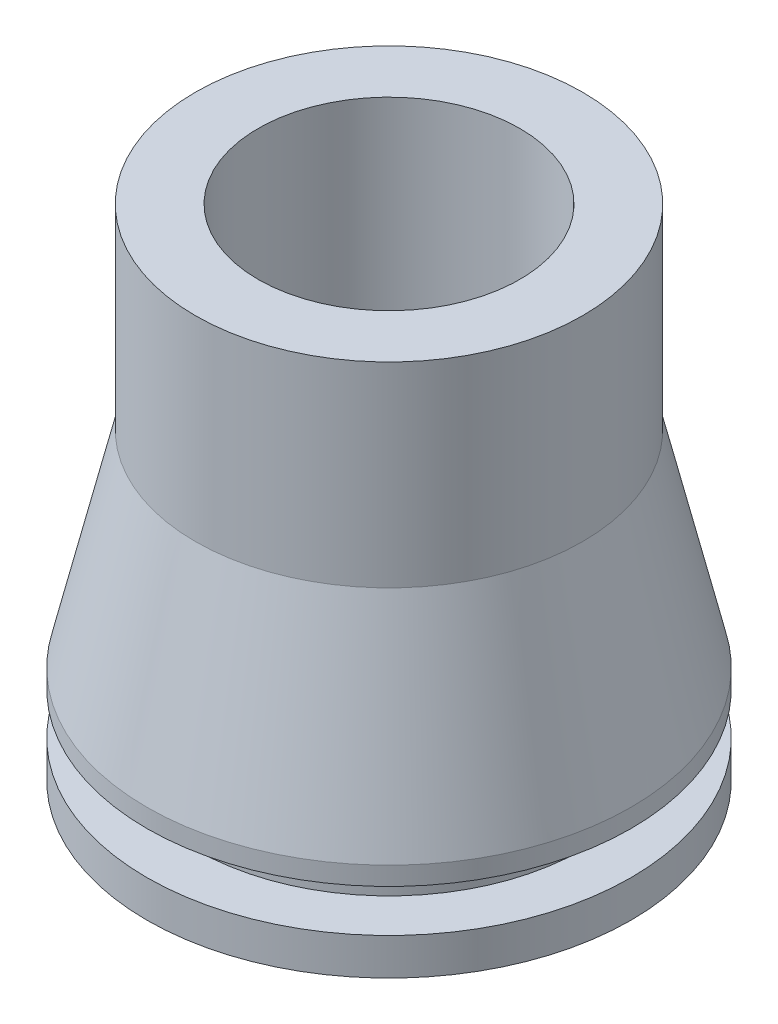
from build123d import *


with BuildPart() as part:
    # Sketch1 → Revolve1 (revolve)
    with BuildSketch(Plane.XY, mode=Mode.PRIVATE) as revolve1_sk:
        Polygon((3.60045, 0), (3.60045, 13.7414), (5.32765, 13.7414), (5.32765, 8.3566), (6.66115, 2.6924), (6.66115, 2.1844), (5.32765, 2.1844), (5.32765, 1.016), (6.66115, 1.016), (6.66115, 0), align=None)
    revolve(revolve1_sk.sketch.rotate(Axis((0, 0, 0), (0, 1, 0)), 90), axis=Axis((0, 0, 0), (0, 1, 0)))


solid = part.part
